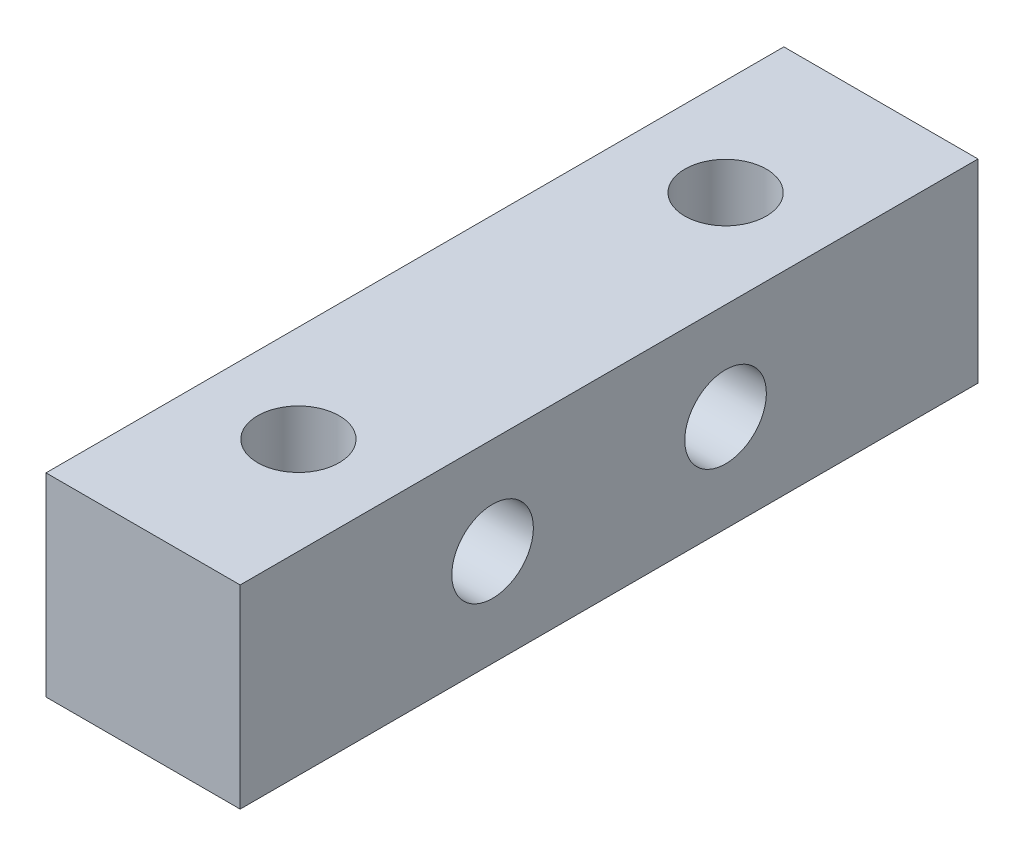
from build123d import *

# Parameters (mm, degrees)
SKETCH_1_W          = 10
SKETCH_1_H          = 10
EXTRUDE_1_DEPTH     = 38
CUT_EXTRUDE_1_DEPTH = 22
SKETCH_4_R          = 2.1
CUT_EXTRUDE_2_DEPTH = 22


with BuildPart() as part:
    # 草图1 → 凸台-拉伸1 (new body)
    with BuildSketch(Plane.XY):
        with Locations((5, 5)):
            Rectangle(SKETCH_1_W, SKETCH_1_H)
    extrude(amount=EXTRUDE_1_DEPTH)

    # 草图3 → 切除-拉伸1 (cut)
    with BuildSketch(Plane(origin=(0, 10, 0), x_dir=(1, 0, 0), z_dir=(0, 1, 0))):
        with BuildLine():
            ThreePointArc((7.1, -8), (6.48492424, -6.51507576), (5, -5.9))
            Line((5, -5.9), (5, -10.1))
            ThreePointArc((5, -10.1), (6.48492424, -9.48492424), (7.1, -8))
        make_face()
        with BuildLine():
            Line((5, -10.1), (5, -5.9))
            ThreePointArc((5, -5.9), (2.9, -8), (5, -10.1))
        make_face()
        with BuildLine():
            ThreePointArc((7.1, -30), (6.48492424, -28.51507576), (5, -27.9))
            Line((5, -27.9), (5, -32.1))
            ThreePointArc((5, -32.1), (6.48492424, -31.48492424), (7.1, -30))
        make_face()
        with BuildLine():
            Line((5, -32.1), (5, -27.9))
            ThreePointArc((5, -27.9), (2.9, -30), (5, -32.1))
        make_face()
    extrude(amount=-CUT_EXTRUDE_1_DEPTH, mode=Mode.SUBTRACT)

    # 草图4 → 切除-拉伸2 (cut)
    with BuildSketch(Plane(origin=(10, 0, 0), x_dir=(0, 0, -1), z_dir=(1, 0, 0))):
        with Locations(Location((-25, 5, 0), (0, 0, 90))):
            Circle(SKETCH_4_R)
        with Locations(Location((-13, 5, 0), (0, 0, 90))):
            Circle(SKETCH_4_R)
    extrude(amount=-CUT_EXTRUDE_2_DEPTH, mode=Mode.SUBTRACT)


solid = part.part
